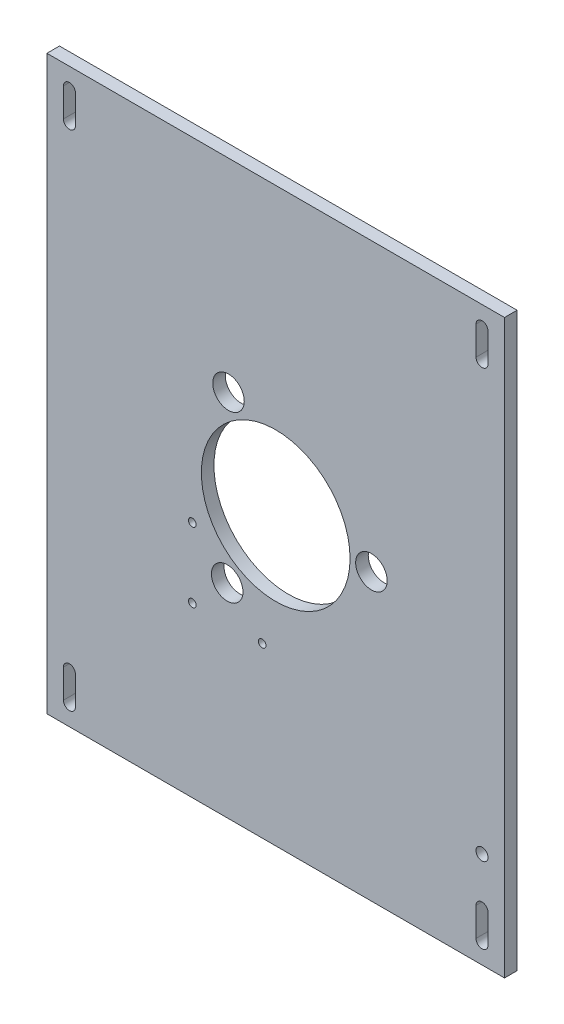
from build123d import *

# Parameters (mm, degrees)
SKETCH1_W                                = 203.2
SKETCH1_H                                = 254
SKETCH1_R                                = 33.02
BOSS_EXTRUDE1_DEPTH                      = 5.588
SKETCH7_R                                = 7
CUT_EXTRUDE6_DEPTH                       = 10
CIRPATTERN2_COUNT                        = 3
SKETCH9_R                                = 1.7
CUT_EXTRUDE8_DEPTH                       = 163.735324205
SKETCH10_R                               = 2.665
CUT_EXTRUDE9_DEPTH                       = 498.241984141
CUT_EXTRUDE10_DEPTH                      = 163.735324205
MIRROR1_AT_THE_SECOND_PLANE_COPY_1_DEPTH = 163.735324205


with BuildPart() as part:
    # Sketch1 → Boss-Extrude1 (new body)
    with BuildSketch(Plane.XY):
        Rectangle(SKETCH1_W, SKETCH1_H)
        Circle(SKETCH1_R, mode=Mode.SUBTRACT)
    extrude(amount=BOSS_EXTRUDE1_DEPTH)

    # Sketch7 → Cut-Extrude6 (cut)
    with BuildSketch(Plane(origin=(-207.785981093, -42.996428153, 5.588), x_dir=(0.9999282090774324, -0.011982349151927488, 0), z_dir=(0, 0, 1))):
        with Locations(Location((249.755489637, 45.661901138, 0), (0, 0, 0.686554465))):
            Circle(SKETCH7_R)
    cut_extrude6 = extrude(amount=-CUT_EXTRUDE6_DEPTH, mode=Mode.SUBTRACT)

    # CirPattern2: Cut-Extrude6 ×3 about axis
    cirpattern2_axis = Axis((0, 0, 0), (0, 0, 1))
    for i in range(1, CIRPATTERN2_COUNT):
        add(cut_extrude6.rotate(cirpattern2_axis, i * 360 / CIRPATTERN2_COUNT), mode=Mode.SUBTRACT)

    # Sketch9 → Cut-Extrude8 (cut, through all)
    with BuildSketch(Plane(origin=(0, 0, 0), x_dir=(-1, 0, 0), z_dir=(0, 0, -1))):
        with Locations((37.035546616, -21.139735697)):
            Circle(SKETCH9_R)
        with Locations((37.035546616, -52.139735697)):
            Circle(SKETCH9_R)
        with Locations((6.035546616, -52.139735697)):
            Circle(SKETCH9_R)
    extrude(amount=-CUT_EXTRUDE8_DEPTH, mode=Mode.SUBTRACT)

    # Sketch10 → Cut-Extrude9 (cut, through all)
    with BuildSketch(Plane(origin=(-338.26084164, -104.82063118, 5.588), x_dir=(0.9999190535665993, -0.012723455288419916, 0), z_dir=(0, 0, 1))):
        with Locations(Location((429.565270691, 25.963287337, 0), (0, 0, 0.729019959))):
            Circle(SKETCH10_R)
    extrude(amount=-CUT_EXTRUDE9_DEPTH, mode=Mode.SUBTRACT)

    # Sketch11 → Cut-Extrude10 (cut, through all)
    with BuildSketch(Plane(origin=(0, 0, 0), x_dir=(-1, 0, 0), z_dir=(0, 0, -1))):
        with BuildLine():
            Line((-94.265, -118.11), (-94.265, -105.41))
            ThreePointArc((-94.265, -105.41), (-91.6, -102.745), (-88.935, -105.41))
            Line((-88.935, -105.41), (-88.935, -118.11))
            ThreePointArc((-88.935, -118.11), (-91.6, -120.775), (-94.265, -118.11))
        make_face()
    cut_extrude10 = extrude(amount=-CUT_EXTRUDE10_DEPTH, mode=Mode.SUBTRACT)

    # Mirror1: Cut-Extrude10 across plane
    add(cut_extrude10.mirror(Plane(origin=(0, 0, 0), x_dir=(0, 0, 1), z_dir=(1, 0, 0))), mode=Mode.SUBTRACT)

    # Mirror1 at the second plane: Cut-Extrude10 across plane
    add(cut_extrude10.mirror(Plane.ZX), mode=Mode.SUBTRACT)

    # Mirror1 at the second plane copy 1 sketc → Mirror1 at the second plane copy 1 (cut, through all)
    with BuildSketch(Plane(origin=(0, 0, 0), x_dir=(1, 0, 0), z_dir=(0, 0, -1))):
        with BuildLine():
            Line((-94.265, -118.11), (-94.265, -105.41))
            ThreePointArc((-94.265, -105.41), (-91.6, -102.745), (-88.935, -105.41))
            Line((-88.935, -105.41), (-88.935, -118.11))
            ThreePointArc((-88.935, -118.11), (-91.6, -120.775), (-94.265, -118.11))
        make_face()
    extrude(amount=-MIRROR1_AT_THE_SECOND_PLANE_COPY_1_DEPTH, mode=Mode.SUBTRACT)


solid = part.part
